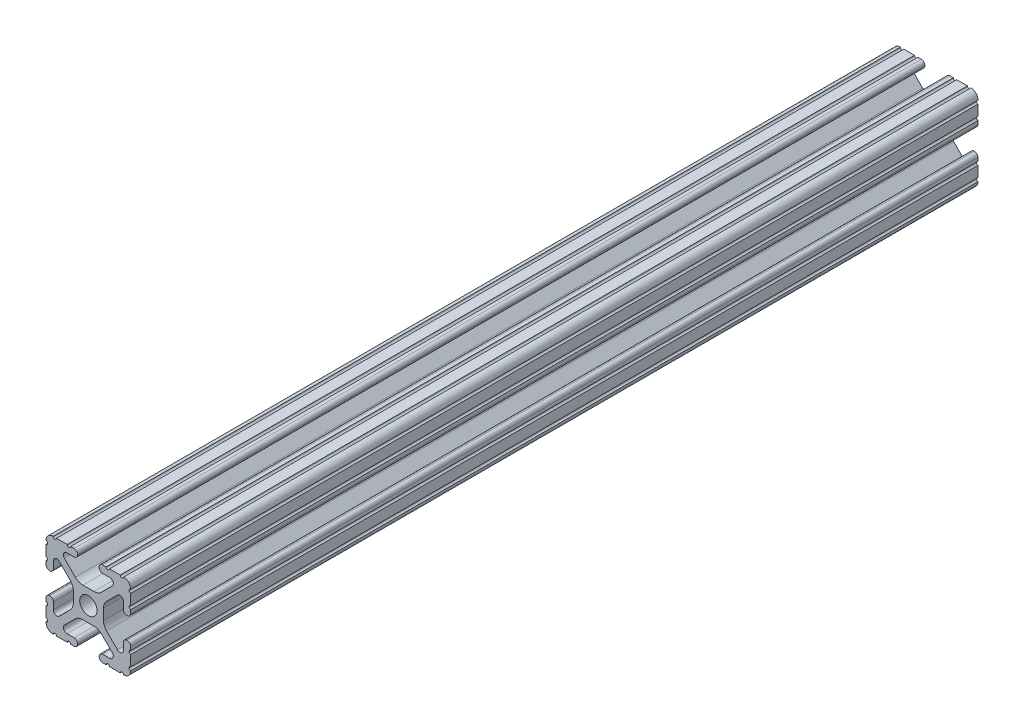
from build123d import *

# Parameters (mm, degrees)
SKETCH1_R           = 2.6035
BOSS_EXTRUDE1_DEPTH = 127


with BuildPart() as part:
    # Sketch1 → Boss-Extrude1 (new, symmetric)
    with BuildSketch(Plane.XY):
        with BuildLine():
            Line((-7.179650497, -8.645192506), (-3.952270251, -5.423690499))
            ThreePointArc((-3.952270251, -5.423690499), (-2.922936451, -4.736929036), (-1.709253557, -4.4958))
            Line((-1.709253557, -4.4958), (1.709253557, -4.4958))
            ThreePointArc((1.709253557, -4.4958), (2.922936451, -4.736929036), (3.952270251, -5.423690499))
            Line((3.952270251, -5.423690499), (7.179650497, -8.645192506))
            ThreePointArc((7.179650497, -8.645192506), (7.41473083, -9.822813117), (6.416408329, -10.4902))
            Line((6.416408329, -10.4902), (4.287512407, -10.4902))
            ThreePointArc((4.287512407, -10.4902), (3.54574862, -10.79744862), (3.2385, -11.539212407))
            Line((3.2385, -11.539212407), (3.2385, -11.650987593))
            ThreePointArc((3.2385, -11.650987593), (3.54574862, -12.39275138), (4.287512407, -12.7))
            Line((4.287512407, -12.7), (5.317126718, -12.7))
            ThreePointArc((5.317126718, -12.7), (5.825126718, -12.192), (6.333126718, -12.7))
            Line((6.333126718, -12.7), (9.550443118, -12.7))
            ThreePointArc((9.550443118, -12.7), (10.058366869, -12.192000006), (10.566443095, -12.699847501))
            ThreePointArc((10.566443095, -12.699847501), (12.082537762, -12.08250727), (12.699846982, -10.566399977))
            ThreePointArc((12.699846982, -10.566399977), (12.192000006, -10.058323491), (12.7, -9.5504))
            Line((12.7, -9.5504), (12.7, -6.3330836))
            ThreePointArc((12.7, -6.3330836), (12.192, -5.8250836), (12.7, -5.3170836))
            Line((12.7, -5.3170836), (12.7, -4.287469289))
            ThreePointArc((12.7, -4.287469289), (12.39275138, -3.545705502), (11.650987593, -3.238456882))
            Line((11.650987593, -3.238456882), (11.539212407, -3.238456882))
            ThreePointArc((11.539212407, -3.238456882), (10.79744862, -3.545705502), (10.4902, -4.287469289))
            Line((10.4902, -4.287469289), (10.4902, -6.402089023))
            ThreePointArc((10.4902, -6.402089023), (9.856505071, -7.351067942), (8.737131347, -7.129408934))
            Line((8.737131347, -7.129408934), (5.441005833, -3.840816462))
            ThreePointArc((5.441005833, -3.840816462), (4.750877967, -2.809883091), (4.5085, -1.593185507))
            Line((4.5085, -1.593185507), (4.5085, 1.593185507))
            ThreePointArc((4.5085, 1.593185507), (4.750877967, 2.809883091), (5.441005833, 3.840816462))
            Line((5.441005833, 3.840816462), (8.737131347, 7.129408934))
            ThreePointArc((8.737131347, 7.129408934), (9.856505071, 7.351067942), (10.4902, 6.402089023))
            Line((10.4902, 6.402089023), (10.4902, 4.287469289))
            ThreePointArc((10.4902, 4.287469289), (10.79744862, 3.545705502), (11.539212407, 3.238456882))
            Line((11.539212407, 3.238456882), (11.650987593, 3.238456882))
            ThreePointArc((11.650987593, 3.238456882), (12.39275138, 3.545705502), (12.7, 4.287469289))
            Line((12.7, 4.287469289), (12.7, 5.3170836))
            ThreePointArc((12.7, 5.3170836), (12.192, 5.8250836), (12.7, 6.3330836))
            Line((12.7, 6.3330836), (12.7, 9.5504))
            ThreePointArc((12.7, 9.5504), (12.192000006, 10.058323491), (12.699846982, 10.566399977))
            ThreePointArc((12.699846982, 10.566399977), (12.082537762, 12.08250727), (10.566443095, 12.699847501))
            ThreePointArc((10.566443095, 12.699847501), (10.058366869, 12.192000006), (9.550443118, 12.7))
            Line((9.550443118, 12.7), (6.333126718, 12.7))
            ThreePointArc((6.333126718, 12.7), (5.825126718, 12.192), (5.317126718, 12.7))
            Line((5.317126718, 12.7), (4.287512407, 12.7))
            ThreePointArc((4.287512407, 12.7), (3.54574862, 12.39275138), (3.2385, 11.650987593))
            Line((3.2385, 11.650987593), (3.2385, 11.539212407))
            ThreePointArc((3.2385, 11.539212407), (3.54574862, 10.79744862), (4.287512407, 10.4902))
            Line((4.287512407, 10.4902), (6.476788598, 10.4902))
            ThreePointArc((6.476788598, 10.4902), (7.432222385, 9.85140422), (7.207036008, 8.724370562))
            Line((7.207036008, 8.724370562), (3.898272566, 5.423169045))
            ThreePointArc((3.898272566, 5.423169045), (2.869120213, 4.736787962), (1.655778399, 4.4958))
            Line((1.655778399, 4.4958), (-1.655778399, 4.4958))
            ThreePointArc((-1.655778399, 4.4958), (-2.869120213, 4.736787962), (-3.898272566, 5.423169045))
            Line((-3.898272566, 5.423169045), (-7.207036008, 8.724370562))
            ThreePointArc((-7.207036008, 8.724370562), (-7.432222385, 9.85140422), (-6.476788598, 10.4902))
            Line((-6.476788598, 10.4902), (-4.287512407, 10.4902))
            ThreePointArc((-4.287512407, 10.4902), (-3.54574862, 10.79744862), (-3.2385, 11.539212407))
            Line((-3.2385, 11.539212407), (-3.2385, 11.650987593))
            ThreePointArc((-3.2385, 11.650987593), (-3.54574862, 12.39275138), (-4.287512407, 12.7))
            Line((-4.287512407, 12.7), (-5.317126718, 12.7))
            ThreePointArc((-5.317126718, 12.7), (-5.825126718, 12.192), (-6.333126718, 12.7))
            Line((-6.333126718, 12.7), (-9.550443118, 12.7))
            ThreePointArc((-9.550443118, 12.7), (-10.058366869, 12.192000006), (-10.566443095, 12.699847501))
            ThreePointArc((-10.566443095, 12.699847501), (-12.082537762, 12.08250727), (-12.699846982, 10.566399977))
            ThreePointArc((-12.699846982, 10.566399977), (-12.192000006, 10.058323491), (-12.7, 9.5504))
            Line((-12.7, 9.5504), (-12.7, 6.3330836))
            ThreePointArc((-12.7, 6.3330836), (-12.192, 5.8250836), (-12.7, 5.3170836))
            Line((-12.7, 5.3170836), (-12.7, 4.287469289))
            ThreePointArc((-12.7, 4.287469289), (-12.39275138, 3.545705502), (-11.650987593, 3.238456882))
            Line((-11.650987593, 3.238456882), (-11.539212407, 3.238456882))
            ThreePointArc((-11.539212407, 3.238456882), (-10.79744862, 3.545705502), (-10.4902, 4.287469289))
            Line((-10.4902, 4.287469289), (-10.4902, 6.402089023))
            ThreePointArc((-10.4902, 6.402089023), (-9.856505071, 7.351067942), (-8.737131347, 7.129408934))
            Line((-8.737131347, 7.129408934), (-5.441005833, 3.840816462))
            ThreePointArc((-5.441005833, 3.840816462), (-4.750877967, 2.809883091), (-4.5085, 1.593185507))
            Line((-4.5085, 1.593185507), (-4.5085, -1.593185507))
            ThreePointArc((-4.5085, -1.593185507), (-4.750877967, -2.809883091), (-5.441005833, -3.840816462))
            Line((-5.441005833, -3.840816462), (-8.737131347, -7.129408934))
            ThreePointArc((-8.737131347, -7.129408934), (-9.856505071, -7.351067942), (-10.4902, -6.402089023))
            Line((-10.4902, -6.402089023), (-10.4902, -4.287469289))
            ThreePointArc((-10.4902, -4.287469289), (-10.79744862, -3.545705502), (-11.539212407, -3.238456882))
            Line((-11.539212407, -3.238456882), (-11.650987593, -3.238456882))
            ThreePointArc((-11.650987593, -3.238456882), (-12.39275138, -3.545705502), (-12.7, -4.287469289))
            Line((-12.7, -4.287469289), (-12.7, -5.3170836))
            ThreePointArc((-12.7, -5.3170836), (-12.192, -5.8250836), (-12.7, -6.3330836))
            Line((-12.7, -6.3330836), (-12.7, -9.5504))
            ThreePointArc((-12.7, -9.5504), (-12.192000006, -10.058323491), (-12.699846982, -10.566399977))
            ThreePointArc((-12.699846982, -10.566399977), (-12.082537762, -12.08250727), (-10.566443095, -12.699847501))
            ThreePointArc((-10.566443095, -12.699847501), (-10.058366869, -12.192000006), (-9.550443118, -12.7))
            Line((-9.550443118, -12.7), (-6.333126718, -12.7))
            ThreePointArc((-6.333126718, -12.7), (-5.825126718, -12.192), (-5.317126718, -12.7))
            Line((-5.317126718, -12.7), (-4.287512407, -12.7))
            ThreePointArc((-4.287512407, -12.7), (-3.54574862, -12.39275138), (-3.2385, -11.650987593))
            Line((-3.2385, -11.650987593), (-3.2385, -11.539212407))
            ThreePointArc((-3.2385, -11.539212407), (-3.54574862, -10.79744862), (-4.287512407, -10.4902))
            Line((-4.287512407, -10.4902), (-6.416408329, -10.4902))
            ThreePointArc((-6.416408329, -10.4902), (-7.41473083, -9.822813117), (-7.179650497, -8.645192506))
        make_face()
        Circle(SKETCH1_R, mode=Mode.SUBTRACT)
    extrude(amount=BOSS_EXTRUDE1_DEPTH, both=True)


solid = part.part
